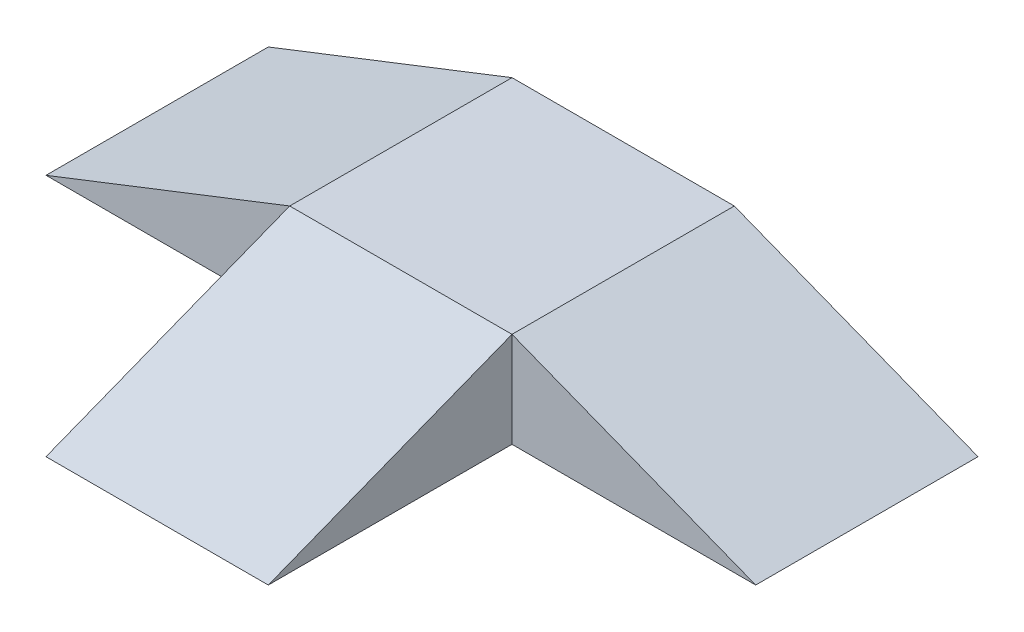
from build123d import *

# Parameters (mm, degrees)
SKETCH1_W           = 350
SKETCH1_H           = 350
BOSS_EXTRUDE1_DEPTH = 150
BOSS_EXTRUDE2_DEPTH = 175
BOSS_EXTRUDE3_DEPTH = 175


with BuildPart() as part:
    # Sketch1 → Boss-Extrude1 (new body)
    with BuildSketch(Plane(origin=(0, 0, 0), x_dir=(1, 0, 0), z_dir=(0, 1, 0))):
        Rectangle(SKETCH1_W, SKETCH1_H)
    extrude(amount=BOSS_EXTRUDE1_DEPTH)

    # Sketch2 → Boss-Extrude2 (add, symmetric)
    with BuildSketch(Plane(origin=(0, 0, 0), x_dir=(0, 0, -1), z_dir=(1, 0, 0))):
        Polygon((-175, 150), (-175, 0), (-558.723859044, 0), align=None)
    extrude(amount=BOSS_EXTRUDE2_DEPTH, both=True)

    # Sketch3 → Boss-Extrude3 (add, symmetric)
    with BuildSketch(Plane.XY):
        Polygon((-175, 150), (-558.723859044, 0), (-175, 0), align=None)
        Polygon((175, 150), (175, 0), (558.723859044, 0), align=None)
    extrude(amount=BOSS_EXTRUDE3_DEPTH, both=True)


solid = part.part
